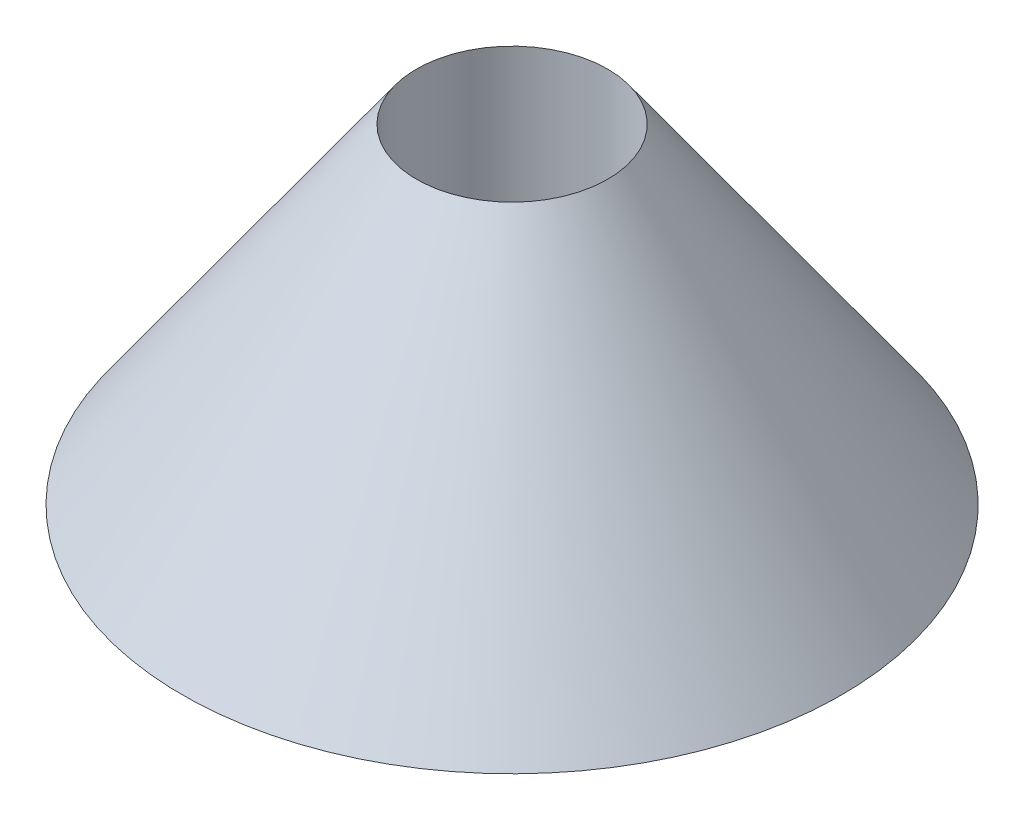
from build123d import *


with BuildPart() as part:
    # Croquis2 → Revolución1 (revolve)
    with BuildSketch(Plane.XY, mode=Mode.PRIVATE) as revoluci_n1_sk:
        Polygon((-59.96608578, -10.813327674), (-64.96608578, -10.813327674), (-61.41608578, -5.813327674), (-61.41608578, -9.313327674), (-59.96608578, -9.313327674), align=None)
    revolve(revoluci_n1_sk.sketch.rotate(Axis((-59.96608578, -10.813327674, 0), (0, 1, 0)), 270), axis=Axis((-59.96608578, -10.813327674, 0), (0, 1, 0)))


solid = part.part
